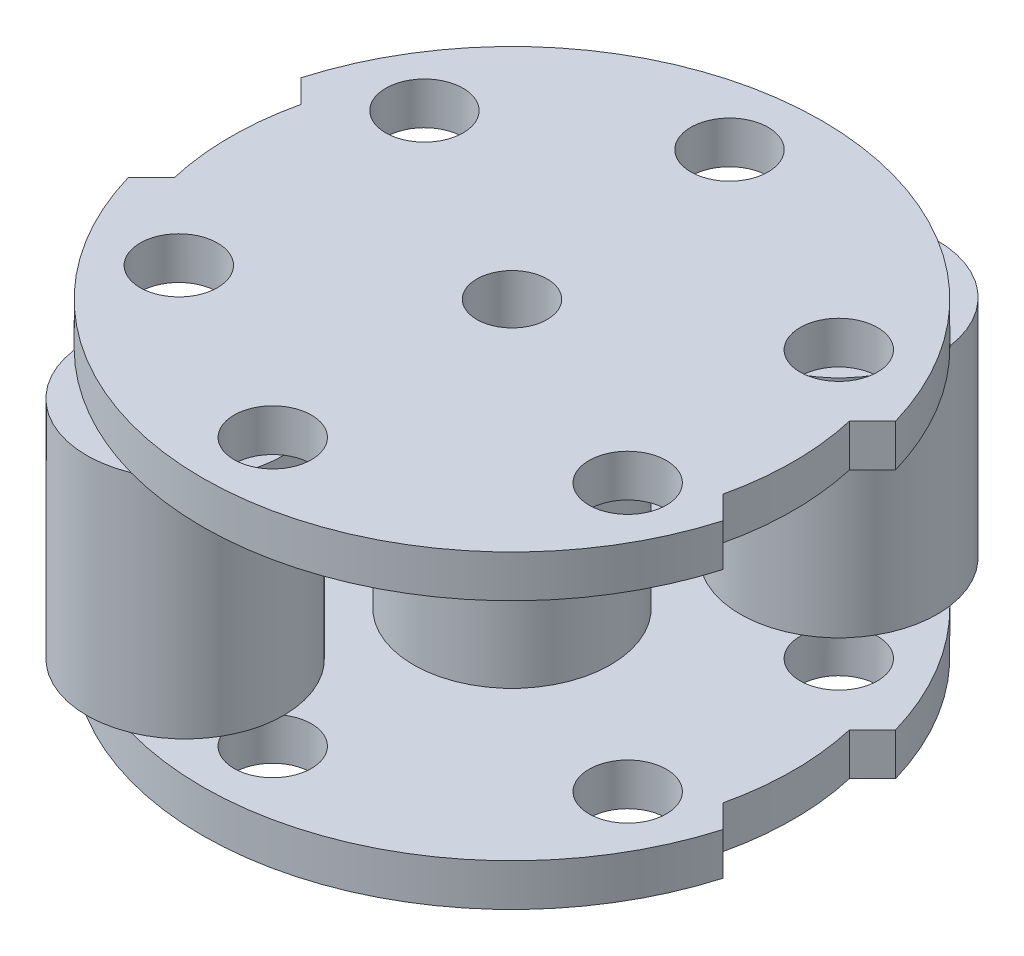
from build123d import *

# Parameters (mm, degrees)
SKETCH1_R           = 7
SKETCH1_R_2         = 2.75
BOSS_EXTRUDE1_DEPTH = 3
SKETCH2_R           = 7
BOSS_EXTRUDE2_DEPTH = 16
SKETCH3_R           = 7
BOSS_EXTRUDE3_DEPTH = 26
CUT_EXTRUDE1_DEPTH  = 9
SKETCH5_R           = 9
SKETCH5_R_2         = 7
BOSS_EXTRUDE4_DEPTH = 0.5
SKETCH6_R           = 2.5
CUT_EXTRUDE2_DEPTH  = 17


with BuildPart() as part:
    # Sketch1 → Boss-Extrude1 (new body)
    with BuildSketch(Plane(origin=(0, 0, 0), x_dir=(1, 0, 0), z_dir=(0, 1, 0))):
        with BuildLine():
            Line((19.48717527, -4.5), (21.126127543, -6.138952274))
            ThreePointArc((21.126127543, -6.138952274), (0, -22), (-21.126127543, -6.138952274))
            Line((-21.126127543, -6.138952274), (-19.48717527, -4.5))
            ThreePointArc((-19.48717527, -4.5), (-20, 0), (-19.48717527, 4.5))
            Line((-19.48717527, 4.5), (-21.126127543, 6.138952274))
            ThreePointArc((-21.126127543, 6.138952274), (0, 22), (21.126127543, 6.138952274))
            Line((21.126127543, 6.138952274), (19.48717527, 4.5))
            ThreePointArc((19.48717527, 4.5), (20, 0), (19.48717527, -4.5))
        make_face()
        with Locations(Location((0, 0, 0), (0, 0, 270))):
            Circle(SKETCH1_R, mode=Mode.SUBTRACT)
        with Locations(Location((0, -17, 0), (0, 0, 270))):
            Circle(SKETCH1_R_2, mode=Mode.SUBTRACT)
        with Locations(Location((-14.722431864, 8.5, 0), (0, 0, 270))):
            Circle(SKETCH1_R_2, mode=Mode.SUBTRACT)
        with Locations(Location((14.722431864, 8.5, 0), (0, 0, 270))):
            Circle(SKETCH1_R_2, mode=Mode.SUBTRACT)
        with Locations(Location((15.40723238, -7.18451045, 0), (0, 0, 270))):
            Circle(SKETCH1_R_2, mode=Mode.SUBTRACT)
        with Locations(Location((-13.925584753, -9.750799418, 0), (0, 0, 270))):
            Circle(SKETCH1_R_2, mode=Mode.SUBTRACT)
        with Locations(Location((-1.481647627, 16.935309868, 0), (0, 0, 270))):
            Circle(SKETCH1_R_2, mode=Mode.SUBTRACT)
    boss_extrude1 = extrude(amount=BOSS_EXTRUDE1_DEPTH)

    # Sketch2 → Boss-Extrude2 (add)
    with BuildSketch(Plane.XZ):
        with Locations(Location((-8.5, 14.722431864, 0), (0, 0, 67.839045349))):
            Circle(SKETCH2_R)
        with Locations(Location((8.5, -14.722431864, 0), (0, 0, 60.223318028))):
            Circle(SKETCH2_R)
    extrude(amount=BOSS_EXTRUDE2_DEPTH)

    # Mirror1: Boss-Extrude1 across plane
    add(boss_extrude1.mirror(Plane(origin=(0, -8, 0), x_dir=(0, 0, 1), z_dir=(0, -1, 0))))

    # Sketch3 → Boss-Extrude3 (add)
    with BuildSketch(Plane(origin=(0, 3, 0), x_dir=(1, 0, 0), z_dir=(0, 1, 0))):
        with Locations(Location((0, 0, 0), (0, 0, 270))):
            Circle(SKETCH3_R)
    extrude(amount=-BOSS_EXTRUDE3_DEPTH)

    # Sketch4 → Cut-Extrude1 (cut)
    with BuildSketch(Plane.XZ.offset(23)):
        with BuildLine():
            Line((1, -1), (1, -3.872983346))
            ThreePointArc((1, -3.872983346), (0, -4), (-1, -3.872983346))
            Line((-1, -3.872983346), (-1, -1))
            Line((-1, -1), (-3.872983346, -1))
            ThreePointArc((-3.872983346, -1), (-4, 0), (-3.872983346, 1))
            Line((-3.872983346, 1), (-1, 1))
            Line((-1, 1), (-1, 3.872983346))
            ThreePointArc((-1, 3.872983346), (0, 4), (1, 3.872983346))
            Line((1, 3.872983346), (1, 1))
            Line((1, 1), (3.872983346, 1))
            ThreePointArc((3.872983346, 1), (4, 0), (3.872983346, -1))
            Line((3.872983346, -1), (1, -1))
        make_face()
    extrude(amount=-CUT_EXTRUDE1_DEPTH, mode=Mode.SUBTRACT)

    # Sketch5 → Boss-Extrude4 (add)
    with BuildSketch(Plane.XZ.offset(19)):
        with Locations(Location((0, 0, 0), (0, 0, 270))):
            Circle(SKETCH5_R)
        with Locations(Location((0, 0, 0), (0, 0, 90))):
            Circle(SKETCH5_R_2, mode=Mode.SUBTRACT)
    extrude(amount=BOSS_EXTRUDE4_DEPTH)

    # Sketch6 → Cut-Extrude2 (cut)
    with BuildSketch(Plane(origin=(0, 3, 0), x_dir=(1, 0, 0), z_dir=(0, 1, 0))):
        with Locations(Location((0, 0, 0), (0, 0, 270))):
            Circle(SKETCH6_R)
    extrude(amount=-CUT_EXTRUDE2_DEPTH, mode=Mode.SUBTRACT)


solid = part.part
